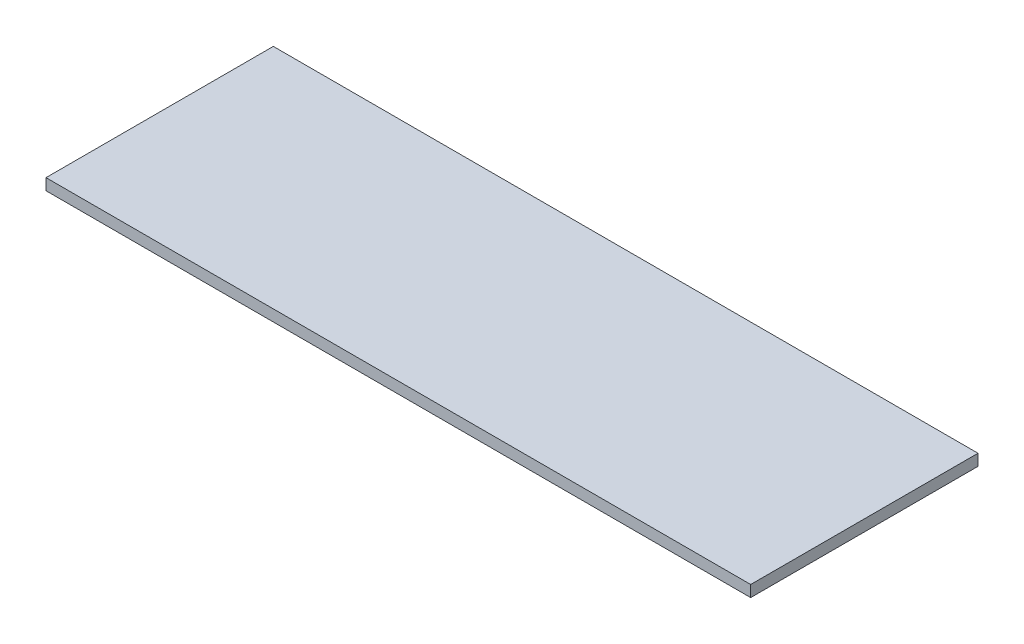
from build123d import *

# Parameters (mm, degrees)
SKETCH1_W           = 196.85
SKETCH1_H           = 63.5
BOSS_EXTRUDE1_DEPTH = 3.175


with BuildPart() as part:
    # Sketch1 → Boss-Extrude1 (new body)
    with BuildSketch(Plane(origin=(0, 0, 0), x_dir=(1, 0, 0), z_dir=(0, 1, 0))):
        Rectangle(SKETCH1_W, SKETCH1_H)
    extrude(amount=BOSS_EXTRUDE1_DEPTH)


solid = part.part
